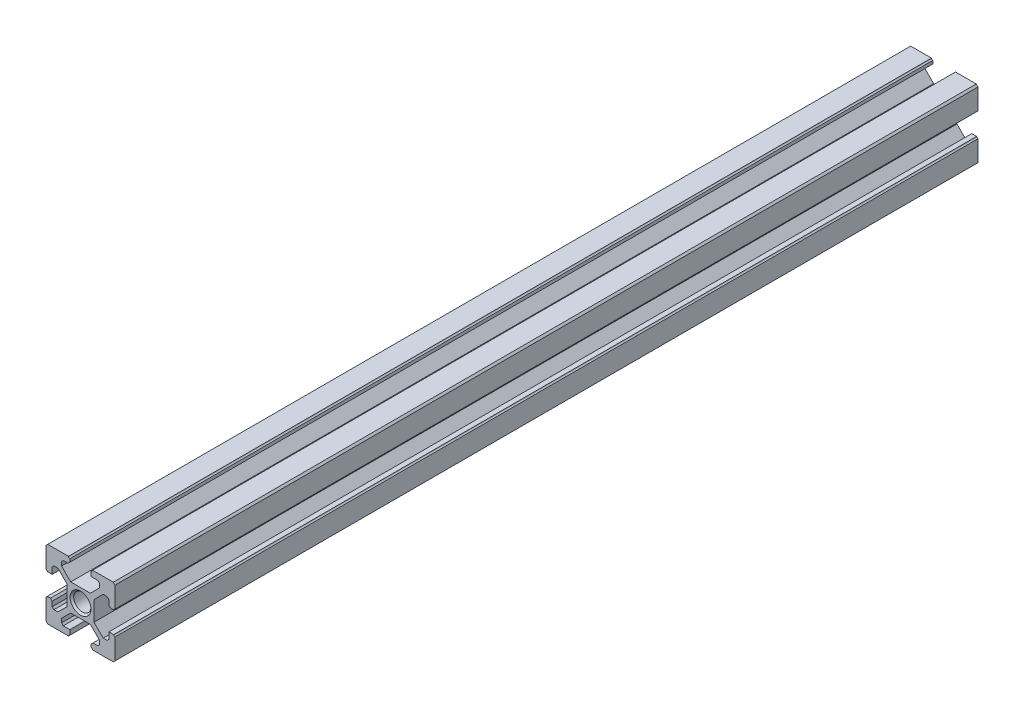
from build123d import *

# Parameters (mm, degrees)
BOSS_EXTRUDE1_DEPTH             = 250
M6X1_0_TAPPED_HOLE2_D           = 5
M6X1_0_TAPPED_HOLE2_DEPTH       = 28.497848452
M6X1_0_TAPPED_HOLE2_CSINK_D     = 6.05
M6X1_0_TAPPED_HOLE2_CSINK_ANGLE = 90
M6X1_0_TAPPED_HOLE2_TIP         = 1.502151548


with BuildPart() as part:
    # Sketch1 → Boss-Extrude1 (new body)
    with BuildSketch(Plane.XY):
        with BuildLine():
            Line((-9.5, 10), (-3.486470896, 10))
            ThreePointArc((-3.486470896, 10), (-3.373276191, 9.726723809), (-3.1, 9.613529104))
            Line((-3.1, 9.613529104), (-3.1, 8.7))
            Line((-3.1, 8.7), (-3.6, 8.2))
            Line((-3.6, 8.2), (-5, 8.2))
            Line((-5, 8.2), (-5.5, 7.7))
            Line((-5.5, 7.7), (-5.5, 6.560660172))
            Line((-5.5, 6.560660172), (-2.839339828, 3.9))
            Line((-2.839339828, 3.9), (0, 3.9))
            Line((0, 3.9), (2.839339828, 3.9))
            Line((2.839339828, 3.9), (5.5, 6.560660172))
            Line((5.5, 6.560660172), (5.5, 7.7))
            Line((5.5, 7.7), (5, 8.2))
            Line((5, 8.2), (3.1, 8.2))
            Line((3.1, 8.2), (3.1, 9.613529104))
            ThreePointArc((3.1, 9.613529104), (3.373276191, 9.726723809), (3.486470896, 10))
            Line((3.486470896, 10), (9.5, 10))
            Line((9.5, 10), (10, 9.5))
            Line((10, 9.5), (10, 3.486470896))
            ThreePointArc((10, 3.486470896), (9.726723809, 3.373276191), (9.613529104, 3.1))
            Line((9.613529104, 3.1), (8.7, 3.1))
            Line((8.7, 3.1), (8.2, 3.6))
            Line((8.2, 3.6), (8.2, 5))
            Line((8.2, 5), (7.7, 5.5))
            Line((7.7, 5.5), (6.560660172, 5.5))
            Line((6.560660172, 5.5), (3.9, 2.839339828))
            Line((3.9, 2.839339828), (3.9, 0))
            Line((3.9, 0), (3.9, -2.839339828))
            Line((3.9, -2.839339828), (6.560660172, -5.5))
            Line((6.560660172, -5.5), (7.7, -5.5))
            Line((7.7, -5.5), (8.2, -5))
            Line((8.2, -5), (8.2, -3.1))
            Line((8.2, -3.1), (9.613529104, -3.1))
            ThreePointArc((9.613529104, -3.1), (9.726723809, -3.373276191), (10, -3.486470896))
            Line((10, -3.486470896), (10, -9.5))
            Line((10, -9.5), (9.5, -10))
            Line((9.5, -10), (3.486470896, -10))
            ThreePointArc((3.486470896, -10), (3.373276191, -9.726723809), (3.1, -9.613529104))
            Line((3.1, -9.613529104), (3.1, -8.7))
            Line((3.1, -8.7), (3.6, -8.2))
            Line((3.6, -8.2), (5, -8.2))
            Line((5, -8.2), (5.5, -7.7))
            Line((5.5, -7.7), (5.5, -6.560660172))
            Line((5.5, -6.560660172), (2.839339828, -3.9))
            Line((2.839339828, -3.9), (0, -3.9))
            Line((0, -3.9), (-2.839339828, -3.9))
            Line((-2.839339828, -3.9), (-5.5, -6.560660172))
            Line((-5.5, -6.560660172), (-5.5, -7.7))
            Line((-5.5, -7.7), (-5, -8.2))
            Line((-5, -8.2), (-3.1, -8.2))
            Line((-3.1, -8.2), (-3.1, -9.613529104))
            ThreePointArc((-3.1, -9.613529104), (-3.373276191, -9.726723809), (-3.486470896, -10))
            Line((-3.486470896, -10), (-9.5, -10))
            Line((-9.5, -10), (-10, -9.5))
            Line((-10, -9.5), (-10, -3.486470896))
            ThreePointArc((-10, -3.486470896), (-9.726723809, -3.373276191), (-9.613529104, -3.1))
            Line((-9.613529104, -3.1), (-8.7, -3.1))
            Line((-8.7, -3.1), (-8.2, -3.6))
            Line((-8.2, -3.6), (-8.2, -5))
            Line((-8.2, -5), (-7.7, -5.5))
            Line((-7.7, -5.5), (-6.560660172, -5.5))
            Line((-6.560660172, -5.5), (-3.9, -2.839339828))
            Line((-3.9, -2.839339828), (-3.9, 0))
            Line((-3.9, 0), (-3.9, 2.839339828))
            Line((-3.9, 2.839339828), (-6.560660172, 5.5))
            Line((-6.560660172, 5.5), (-7.7, 5.5))
            Line((-7.7, 5.5), (-8.2, 5))
            Line((-8.2, 5), (-8.2, 3.1))
            Line((-8.2, 3.1), (-9.613529104, 3.1))
            ThreePointArc((-9.613529104, 3.1), (-9.726723809, 3.373276191), (-10, 3.486470896))
            Line((-10, 3.486470896), (-10, 9.5))
            Line((-10, 9.5), (-9.5, 10))
        make_face()
    extrude(amount=BOSS_EXTRUDE1_DEPTH)

    # Sketch2 → M6x1.0 Tapped Hole1 (revolve, cut)
    with BuildSketch(Plane(origin=(0, 0, 250), x_dir=(0, -1, 0), z_dir=(1, 0, 0))):
        Polygon((0, 0), (0, 30), (2.5, 28.497848452), (2.5, 0.525), (3.025, 0), align=None)
    revolve(axis=Axis((0, 0, 256.35), (0, 0, -1)), mode=Mode.SUBTRACT)

    # M6x1.0 Tapped Hole2
    with Locations(Plane(origin=(0, 0, 0), x_dir=(-1, 0, 0), z_dir=(0, 0, -1))):
        with Locations((0, 0)):
            CounterSinkHole(M6X1_0_TAPPED_HOLE2_D / 2, M6X1_0_TAPPED_HOLE2_CSINK_D / 2, depth=M6X1_0_TAPPED_HOLE2_DEPTH, counter_sink_angle=M6X1_0_TAPPED_HOLE2_CSINK_ANGLE)
            with Locations((0, 0, -(M6X1_0_TAPPED_HOLE2_DEPTH + M6X1_0_TAPPED_HOLE2_TIP / 2))):  # 118° drill point
                Cone(0, M6X1_0_TAPPED_HOLE2_D / 2, M6X1_0_TAPPED_HOLE2_TIP, mode=Mode.SUBTRACT)


solid = part.part
